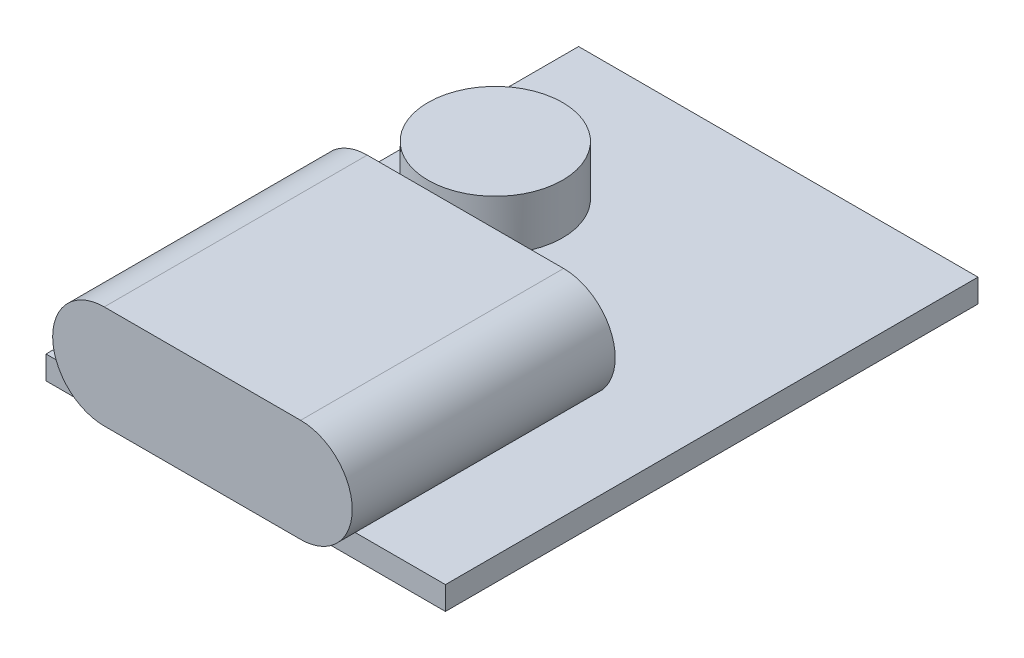
from build123d import *

# Parameters (mm, degrees)
SKETCH_1_W      = 12
SKETCH_1_H      = 16
EXTRUDE_1_DEPTH = 0.7
EXTRUDE_START   = 1.3
EXTRUDE_2_DEPTH = 7.9
SKETCH_3_R      = 2.022600204
EXTRUDE_3_DEPTH = 2.2


with BuildPart() as part:
    # Эскиз1 → Бобышка-Вытянуть1 (new body)
    with BuildSketch(Plane(origin=(0, 0, 0), x_dir=(1, 0, 0), z_dir=(0, 1, 0))):
        with Locations((0, 8)):
            Rectangle(SKETCH_1_W, SKETCH_1_H)
    extrude(amount=EXTRUDE_1_DEPTH)

    # Эскиз3 → Бобышка-Вытянуть3 (add)
    with BuildSketch(Plane(origin=(0, 0, 0), x_dir=(1, 0, 0), z_dir=(0, 1, 0))):
        with Locations(Location((-3.283380281, 10.781918689, 0), (0, 0, 90))):
            Circle(SKETCH_3_R)
    extrude(amount=EXTRUDE_3_DEPTH)


with BuildPart() as body_2:
    # Эскиз2 → Бобышка-Вытянуть2 (new body)
    with BuildSketch(Plane.XY.offset(EXTRUDE_START)):
        with BuildLine():
            Line((-2.95, 4.1), (2.95, 4.1))
            ThreePointArc((2.95, 4.1), (4.5, 2.55), (2.95, 1))
            Line((2.95, 1), (-2.95, 1))
            ThreePointArc((-2.95, 1), (-4.5, 2.55), (-2.95, 4.1))
        make_face()
    extrude(amount=-EXTRUDE_2_DEPTH)


solid = Compound([part.part, body_2.part])
